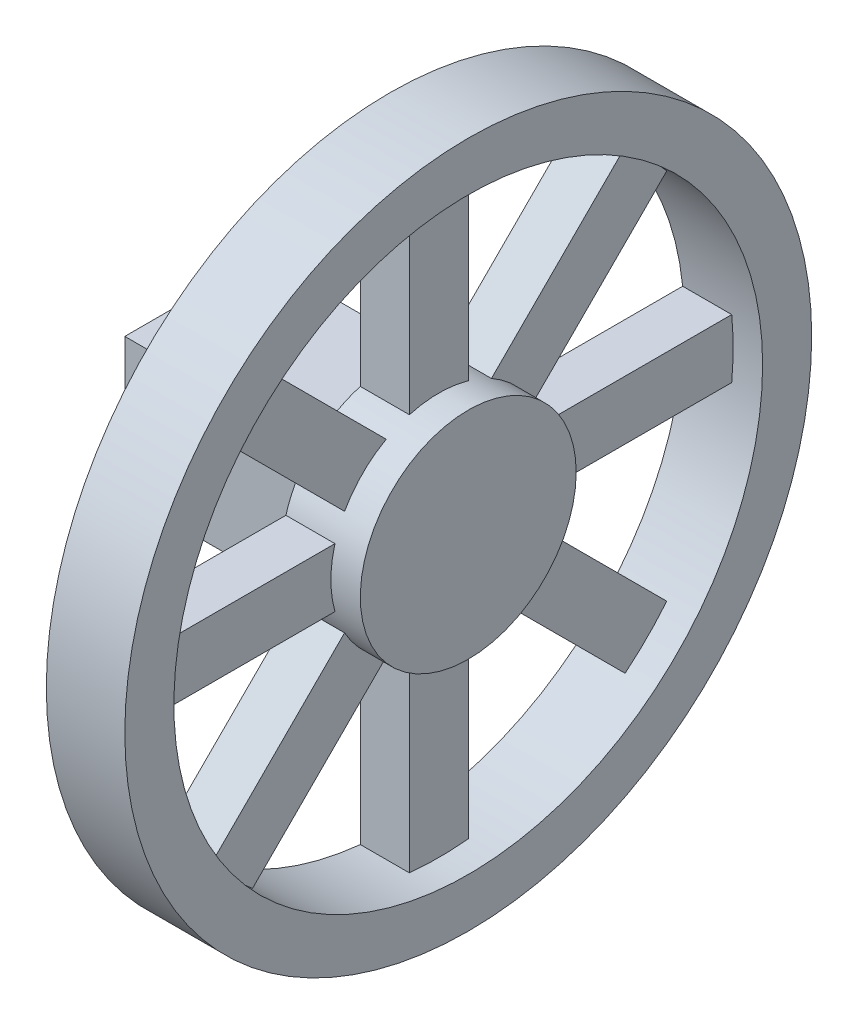
from build123d import *

# Parameters (mm, degrees)
ESQUISSE1_W          = 70
ESQUISSE1_H          = 70
BOSS_EXTRU_1_DEPTH   = 100
ESQUISSE2_R          = 55
BOSS_EXTRU_2_DEPTH   = 40
ESQUISSE2_R_2        = 175
ESQUISSE2_R_3        = 150
BOSS_EXTRU_2_2_DEPTH = 40
BOSS_EXTRU_3_DEPTH   = 25


with BuildPart() as part:
    # Esquisse1 → Boss.-Extru.1 (new body)
    with BuildSketch(Plane(origin=(0, 0, 0), x_dir=(0, 0, -1), z_dir=(1, 0, 0))):
        Rectangle(ESQUISSE1_W, ESQUISSE1_H)
    extrude(amount=BOSS_EXTRU_1_DEPTH)


with BuildPart() as body_2:
    # Esquisse2 → Boss.-Extru.2 (new body)
    with BuildSketch(Plane(origin=(100, 0, 0), x_dir=(0, 0, -1), z_dir=(1, 0, 0))):
        Circle(ESQUISSE2_R)
    extrude(amount=BOSS_EXTRU_2_DEPTH)



with BuildPart() as body_3:
    # Esquisse2 → Boss.-Extru.2 2 (new body)
    with BuildSketch(Plane(origin=(100, 0, 0), x_dir=(0, 0, -1), z_dir=(1, 0, 0))):
        Circle(ESQUISSE2_R_2)
        Circle(ESQUISSE2_R_3, mode=Mode.SUBTRACT)
    extrude(amount=BOSS_EXTRU_2_2_DEPTH)


with BuildPart() as body_2_1:
    add(body_2.part)

    add(body_3.part)  # Boss.-Extru.3 merges body 3
    # Esquisse2<3> → Boss.-Extru.3 (add)
    with BuildSketch(Plane(origin=(100, 0, 0), x_dir=(0, 0, -1), z_dir=(1, 0, 0))):
        with BuildLine():
            ThreePointArc((-15, 52.915026221), (0, 55), (15, 52.915026221))
            Line((15, 52.915026221), (15, 149.248115566))
            ThreePointArc((15, 149.248115566), (0, 150), (-15, 149.248115566))
            Line((-15, 149.248115566), (-15, 52.915026221))
        make_face()
        with BuildLine():
            Line((94.927752878, 116.140956314), (26.80997215, 48.023175586))
            ThreePointArc((26.80997215, 48.023175586), (38.890872965, 38.890872965), (48.023175586, 26.80997215))
            Line((48.023175586, 26.80997215), (116.140956314, 94.927752878))
            ThreePointArc((116.140956314, 94.927752878), (106.066017178, 106.066017178), (94.927752878, 116.140956314))
        make_face()
        with BuildLine():
            ThreePointArc((-48.023175586, 26.80997215), (-38.890872965, 38.890872965), (-26.80997215, 48.023175586))
            Line((-26.80997215, 48.023175586), (-94.927752878, 116.140956314))
            ThreePointArc((-94.927752878, 116.140956314), (-106.066017178, 106.066017178), (-116.140956314, 94.927752878))
            Line((-116.140956314, 94.927752878), (-48.023175586, 26.80997215))
        make_face()
        with BuildLine():
            Line((149.248115566, 15), (52.915026221, 15))
            ThreePointArc((52.915026221, 15), (55, 0), (52.915026221, -15))
            Line((52.915026221, -15), (149.248115566, -15))
            ThreePointArc((149.248115566, -15), (150, 0), (149.248115566, 15))
        make_face()
        with BuildLine():
            ThreePointArc((-52.915026221, -15), (-55, 0), (-52.915026221, 15))
            Line((-52.915026221, 15), (-149.248115566, 15))
            ThreePointArc((-149.248115566, 15), (-150, 0), (-149.248115566, -15))
            Line((-149.248115566, -15), (-52.915026221, -15))
        make_face()
        with BuildLine():
            ThreePointArc((-26.80997215, -48.023175586), (-38.890872965, -38.890872965), (-48.023175586, -26.80997215))
            Line((-48.023175586, -26.80997215), (-116.140956314, -94.927752878))
            ThreePointArc((-116.140956314, -94.927752878), (-106.066017178, -106.066017178), (-94.927752878, -116.140956314))
            Line((-94.927752878, -116.140956314), (-26.80997215, -48.023175586))
        make_face()
        with BuildLine():
            Line((116.140956314, -94.927752878), (48.023175586, -26.80997215))
            ThreePointArc((48.023175586, -26.80997215), (38.890872965, -38.890872965), (26.80997215, -48.023175586))
            Line((26.80997215, -48.023175586), (94.927752878, -116.140956314))
            ThreePointArc((94.927752878, -116.140956314), (106.066017178, -106.066017178), (116.140956314, -94.927752878))
        make_face()
        with BuildLine():
            ThreePointArc((15, -52.915026221), (0, -55), (-15, -52.915026221))
            Line((-15, -52.915026221), (-15, -149.248115566))
            ThreePointArc((-15, -149.248115566), (0, -150), (15, -149.248115566))
            Line((15, -149.248115566), (15, -52.915026221))
        make_face()
    extrude(amount=BOSS_EXTRU_3_DEPTH)


solid = Compound([part.part, body_2_1.part])
